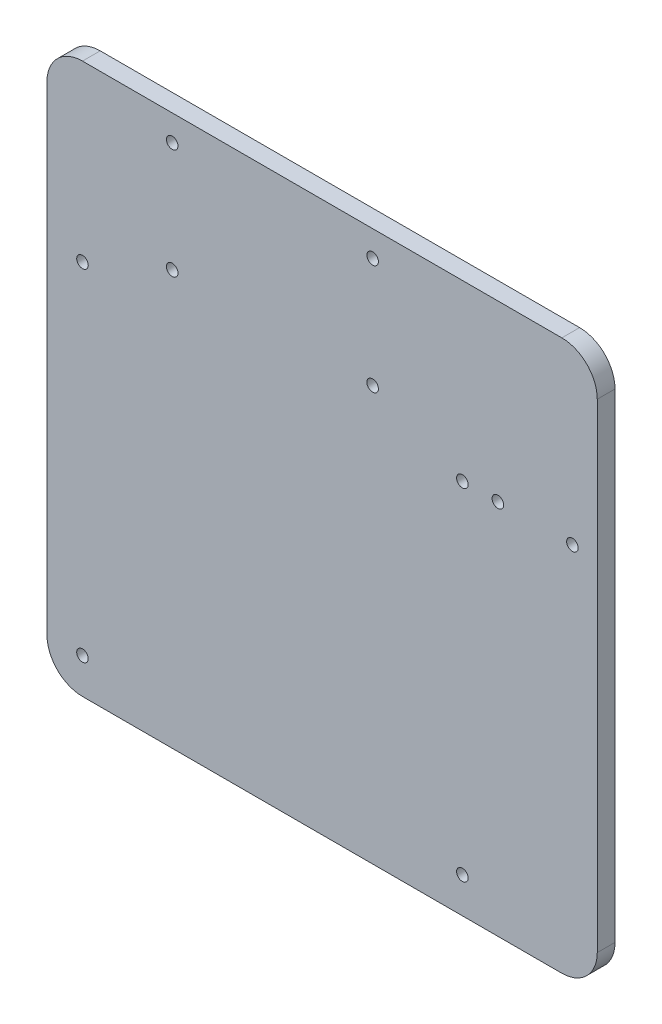
from build123d import *

# Parameters (mm, degrees)
SKETCH1_R           = 1.625
BOSS_EXTRUDE1_DEPTH = 5
CUT_EXTRUDE1_DEPTH  = 5


with BuildPart() as part:
    # Sketch1 → Boss-Extrude1 (new body)
    with BuildSketch(Plane.XY):
        Polygon((-75, 75), (-75, -75), (75, -75), (80, -75), (80, 80), (75, 80), (-75, 80), align=None)
        with Locations((-65, -65)):
            Circle(SKETCH1_R, mode=Mode.SUBTRACT)
        with Locations((-65, 31)):
            Circle(SKETCH1_R, mode=Mode.SUBTRACT)
        with Locations((42, 31)):
            Circle(SKETCH1_R, mode=Mode.SUBTRACT)
        with Locations((42, -65)):
            Circle(SKETCH1_R, mode=Mode.SUBTRACT)
        with Locations((52, 31)):
            Circle(SKETCH1_R, mode=Mode.SUBTRACT)
        with Locations((73, 31)):
            Circle(SKETCH1_R, mode=Mode.SUBTRACT)
        with Locations((-39.728067716, 72.721211314)):
            Circle(SKETCH1_R, mode=Mode.SUBTRACT)
        with Locations((-39.728067716, 41.721211314)):
            Circle(SKETCH1_R, mode=Mode.SUBTRACT)
        with Locations((16.728067716, 41.721211314)):
            Circle(SKETCH1_R, mode=Mode.SUBTRACT)
        with Locations((16.728067716, 72.721211314)):
            Circle(SKETCH1_R, mode=Mode.SUBTRACT)
    extrude(amount=BOSS_EXTRUDE1_DEPTH)

    # Sketch2 → Cut-Extrude1 (cut)
    with BuildSketch(Plane.XY.offset(5)):
        with BuildLine():
            Line((-75, 70.005557821), (-75, 80))
            Line((-75, 80), (-65.005557821, 80))
            ThreePointArc((-65.005557821, 80), (-72.07269566, 77.07269566), (-75, 70.005557821))
        make_face()
        with BuildLine():
            Line((70.02446388, 80), (80, 80))
            Line((80, 80), (80, 70.02446388))
            ThreePointArc((80, 70.02446388), (77.078233116, 77.078233116), (70.02446388, 80))
        make_face()
        with BuildLine():
            Line((69.9697939, -75), (80, -75))
            Line((80, -75), (80, -64.9697939))
            ThreePointArc((80, -64.9697939), (77.06222065, -72.06222065), (69.9697939, -75))
        make_face()
        with BuildLine():
            Line((-75, -65), (-75, -75))
            Line((-75, -75), (-65, -75))
            ThreePointArc((-65, -75), (-72.071067812, -72.071067812), (-75, -65))
        make_face()
    extrude(amount=-CUT_EXTRUDE1_DEPTH, mode=Mode.SUBTRACT)


solid = part.part
